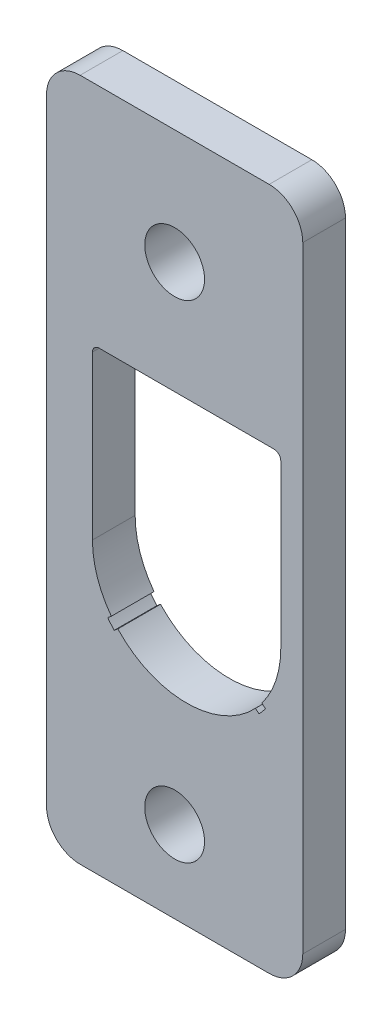
from build123d import *

# Parameters (mm, degrees)
SKETCH1_W           = 38.1
SKETCH1_H           = 101.6
BOSS_EXTRUDE1_DEPTH = 6.35
FILLET1_R           = 5
FILLET2_R           = 5
FILLET3_R           = 5
FILLET4_R           = 5
CUT_EXTRUDE1_REACH  = 180.93
SKETCH2_R           = 4.445


with BuildPart() as part:
    # Sketch1 → Boss-Extrude1 (new body)
    with BuildSketch(Plane.XY):
        with Locations((0, -127)):
            Rectangle(SKETCH1_W, SKETCH1_H)
        with BuildLine():
            Line((-12.222, -110.928), (-12.222, -135.128))
            ThreePointArc((-12.222, -135.128), (-11.501276628, -139.562051447), (-9.413312538, -143.539570822))
            Line((-9.413312538, -143.539570822), (-9.95027795, -143.990138361))
            ThreePointArc((-9.95027795, -143.990138361), (-9.482853323, -144.576977852), (-8.986096678, -145.139204858))
            Line((-8.986096678, -145.139204858), (-8.44913124, -144.688637356))
            ThreePointArc((-8.44913124, -144.688637356), (1.777999803, -149.128000002), (12.005130971, -144.688637644))
            Line((12.005130971, -144.688637644), (12.542096526, -145.139205022))
            ThreePointArc((12.542096526, -145.139205022), (13.038853251, -144.576977937), (13.506277951, -143.99013836))
            Line((13.506277951, -143.99013836), (12.969312655, -143.539570964))
            ThreePointArc((12.969312655, -143.539570964), (15.057276792, -139.562051525), (15.77800018, -135.128))
            Line((15.77800018, -135.128), (15.77800018, -110.928))
            ThreePointArc((15.77800018, -110.928), (15.485106961, -110.220893219), (14.77800018, -109.928))
            Line((14.77800018, -109.928), (-11.222, -109.928))
            ThreePointArc((-11.222, -109.928), (-11.929106781, -110.220893219), (-12.222, -110.928))
        make_face(mode=Mode.SUBTRACT)
    extrude(amount=BOSS_EXTRUDE1_DEPTH)

    # Fillet1
    fillet1_edges = [part.edges().sort_by_distance(p)[0] for p in [
        (-19.05, -76.2, 3.175),
    ]]
    fillet(fillet1_edges, radius=FILLET1_R)

    # Fillet2
    fillet2_edges = [part.edges().sort_by_distance(p)[0] for p in [
        (19.05, -76.2, 3.175),
    ]]
    fillet(fillet2_edges, radius=FILLET2_R)

    # Fillet3
    fillet3_edges = [part.edges().sort_by_distance(p)[0] for p in [
        (19.05, -177.8, 3.175),
    ]]
    fillet(fillet3_edges, radius=FILLET3_R)

    # Fillet4
    fillet4_edges = [part.edges().sort_by_distance(p)[0] for p in [
        (-19.05, -177.8, 3.175),
    ]]
    fillet(fillet4_edges, radius=FILLET4_R)

    # Sketch2 → Cut-Extrude1 (cut, up to next)
    with BuildSketch(Plane.XY.offset(6.35), mode=Mode.PRIVATE) as cut_extrude1_sk1:
        with Locations((0, -93.234389415)):
            Circle(SKETCH2_R)
    cut_extrude1_tool1 = extrude(cut_extrude1_sk1.sketch, amount=-CUT_EXTRUDE1_REACH, mode=Mode.PRIVATE) & part.part
    # Sketch2 → Cut-Extrude1 (cut, up to next)
    with BuildSketch(Plane.XY.offset(6.35), mode=Mode.PRIVATE) as cut_extrude1_sk2:
        with Locations((0, -165.643685175)):
            Circle(SKETCH2_R)
    cut_extrude1_tool2 = extrude(cut_extrude1_sk2.sketch, amount=-CUT_EXTRUDE1_REACH, mode=Mode.PRIVATE) & part.part
    add(cut_extrude1_tool1.solids().sort_by_distance((0, -93.234389, 6.35))[0], mode=Mode.SUBTRACT)
    add(cut_extrude1_tool2.solids().sort_by_distance((0, -165.643685, 6.35))[0], mode=Mode.SUBTRACT)


solid = part.part
